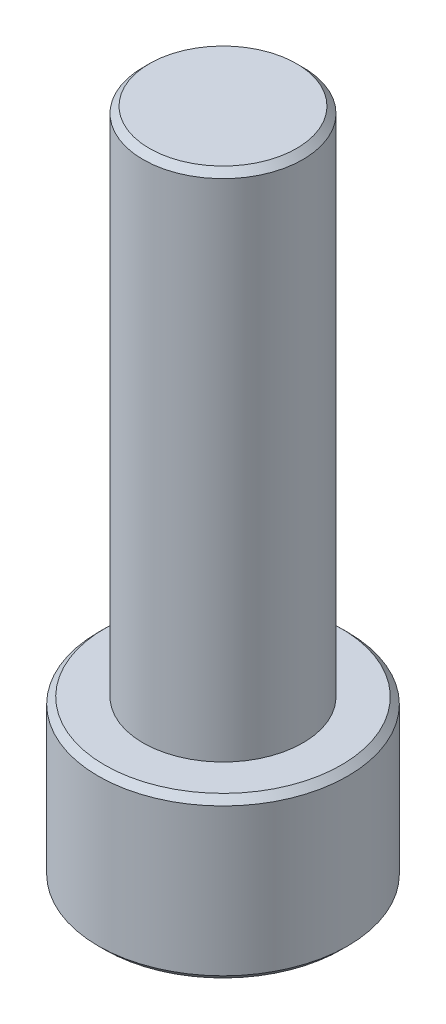
from build123d import *

# Parameters (mm, degrees)
SKETCH_1_R          = 1.95
SKETCH_1_R_2        = 1.25
EXTRUDE_1_DEPTH     = 2.5
SKETCH_1_3_R        = 1.25
EXTRUDE_2_DEPTH     = 8
CUT_EXTRUDE_START   = -1.25
CUT_EXTRUDE_1_DEPTH = 8.211973765
CHAMFER_1_SIZE      = 0.1


with BuildPart() as part:
    # Эскиз1 → Бобышка-Вытянуть1 (new body)
    # profile 1 of 3: a face of its own
    with BuildSketch(Plane(origin=(0, 0, 0), x_dir=(1, 0, 0), z_dir=(0, 1, 0))):
        with Locations(Location((0, 0, 0), (0, 0, 270))):
            Circle(SKETCH_1_R)
        Circle(SKETCH_1_R_2, mode=Mode.SUBTRACT)
    # profile 2 of 3: a face of its own
    with BuildSketch(Plane(origin=(0, 0, 0), x_dir=(1, 0, 0), z_dir=(0, 1, 0))):
        Circle(SKETCH_1_R_2)
        Polygon((1, 0.577350269), (0, 1.154700538), (-1, 0.577350269), (-1, -0.577350269), (0, -1.154700538), (1, -0.577350269), align=None, mode=Mode.SUBTRACT)
    # profile 3 of 3: a face of its own
    with BuildSketch(Plane(origin=(0, 0, 0), x_dir=(1, 0, 0), z_dir=(0, 1, 0))):
        Polygon((1, -0.577350269), (1, 0.577350269), (0, 1.154700538), (-1, 0.577350269), (-1, -0.577350269), (0, -1.154700538), align=None)
    extrude(amount=-EXTRUDE_1_DEPTH)

    # Эскиз1<3> → Бобышка-Вытянуть2 (add)
    # profile 1 of 2: a face of its own
    with BuildSketch(Plane(origin=(0, 0, 0), x_dir=(1, 0, 0), z_dir=(0, 1, 0))):
        with Locations(Location((0, 0, 0), (0, 0, 270))):
            Circle(SKETCH_1_3_R)
        Polygon((1, 0.577350269), (0, 1.154700538), (-1, 0.577350269), (-1, -0.577350269), (0, -1.154700538), (1, -0.577350269), align=None, mode=Mode.SUBTRACT)
    # profile 2 of 2: a face of its own
    with BuildSketch(Plane(origin=(0, 0, 0), x_dir=(1, 0, 0), z_dir=(0, 1, 0))):
        Polygon((1, -0.577350269), (1, 0.577350269), (0, 1.154700538), (-1, 0.577350269), (-1, -0.577350269), (0, -1.154700538), align=None)
    extrude(amount=EXTRUDE_2_DEPTH)

    # Эскиз1<6> → Вырез-Вытянуть1 (cut, through all)
    with BuildSketch(Plane(origin=(0, 0, 0), x_dir=(1, 0, 0), z_dir=(0, 1, 0)).offset(CUT_EXTRUDE_START)):
        Polygon((0, 1.154700538), (-1, 0.577350269), (-1, -0.577350269), (0, -1.154700538), (1, -0.577350269), (1, 0.577350269), align=None)
    extrude(amount=-CUT_EXTRUDE_1_DEPTH, mode=Mode.SUBTRACT)

    # Фаска1
    chamfer_1_edges = [part.edges().sort_by_distance(p)[0] for p in [
        (0, 0, -1.95),
        (0, -2.5, -1.95),
        (0, 8, -1.25),
    ]]
    chamfer(chamfer_1_edges, length=CHAMFER_1_SIZE)


solid = part.part
